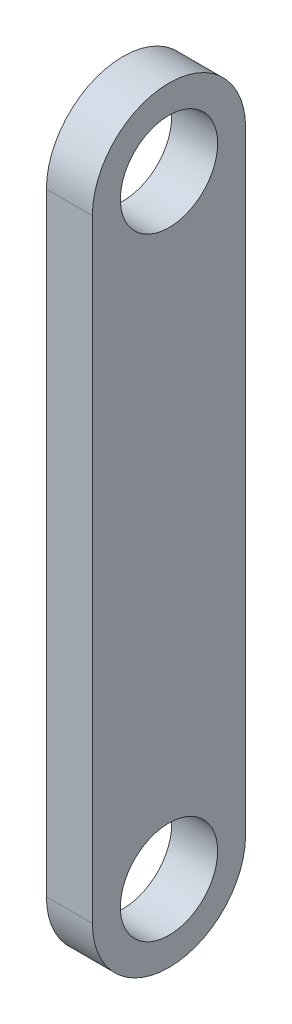
from build123d import *

# Parameters (mm, degrees)
SKETCH3_W           = 10
SKETCH3_H           = 50
BOSS_EXTRUDE1_DEPTH = 3
SKETCH4_R           = 3.175
CUT_EXTRUDE1_DEPTH  = 5
FILLET3_RADIUS      = 5
FILLET3_LENGTH      = 3
FILLET4_RADIUS      = 5
FILLET4_LENGTH      = 3


with BuildPart() as part:
    # Sketch3 → Boss-Extrude1 (new body)
    with BuildSketch(Plane(origin=(0, 0, 0), x_dir=(0, 0, -1), z_dir=(1, 0, 0))):
        Rectangle(SKETCH3_W, SKETCH3_H)
    extrude(amount=BOSS_EXTRUDE1_DEPTH)

    # Sketch4 → Cut-Extrude1 (cut)
    with BuildSketch(Plane(origin=(3, 0, 0), x_dir=(0, 0, -1), z_dir=(1, 0, 0))):
        with Locations((0, 20)):
            Circle(SKETCH4_R)
        with Locations((0, -20)):
            Circle(SKETCH4_R)
    extrude(amount=-CUT_EXTRUDE1_DEPTH, mode=Mode.SUBTRACT)

    # Fillet3: full round fillet: the end face becomes a half cylinder, R = half its width
    fillet3_face = Plane((1.5, 25, 0), x_dir=(-1, 0, 0), z_dir=(0, 1, 0))  # on the end face: x along it, z out of the body
    fillet3_slab = fillet3_face.offset(-FILLET3_RADIUS / 2) * Box(FILLET3_LENGTH, 2 * FILLET3_RADIUS, FILLET3_RADIUS, mode=Mode.PRIVATE)  # the body's end, R deep
    fillet3_round = Plane((1.5, 20, 0), x_dir=(0, 1, 0), z_dir=(-1, 0, 0)) * Cylinder(FILLET3_RADIUS, FILLET3_LENGTH, mode=Mode.PRIVATE)  # its axis R under the face
    add(fillet3_slab - fillet3_round, mode=Mode.SUBTRACT)

    # Fillet4: full round fillet: the end face becomes a half cylinder, R = half its width
    fillet4_face = Plane((1.5, -25, 0), x_dir=(-1, 0, 0), z_dir=(0, -1, 0))  # on the end face: x along it, z out of the body
    fillet4_slab = fillet4_face.offset(-FILLET4_RADIUS / 2) * Box(FILLET4_LENGTH, 2 * FILLET4_RADIUS, FILLET4_RADIUS, mode=Mode.PRIVATE)  # the body's end, R deep
    fillet4_round = Plane((1.5, -20, 0), x_dir=(0, -1, 0), z_dir=(-1, 0, 0)) * Cylinder(FILLET4_RADIUS, FILLET4_LENGTH, mode=Mode.PRIVATE)  # its axis R under the face
    add(fillet4_slab - fillet4_round, mode=Mode.SUBTRACT)


solid = part.part
